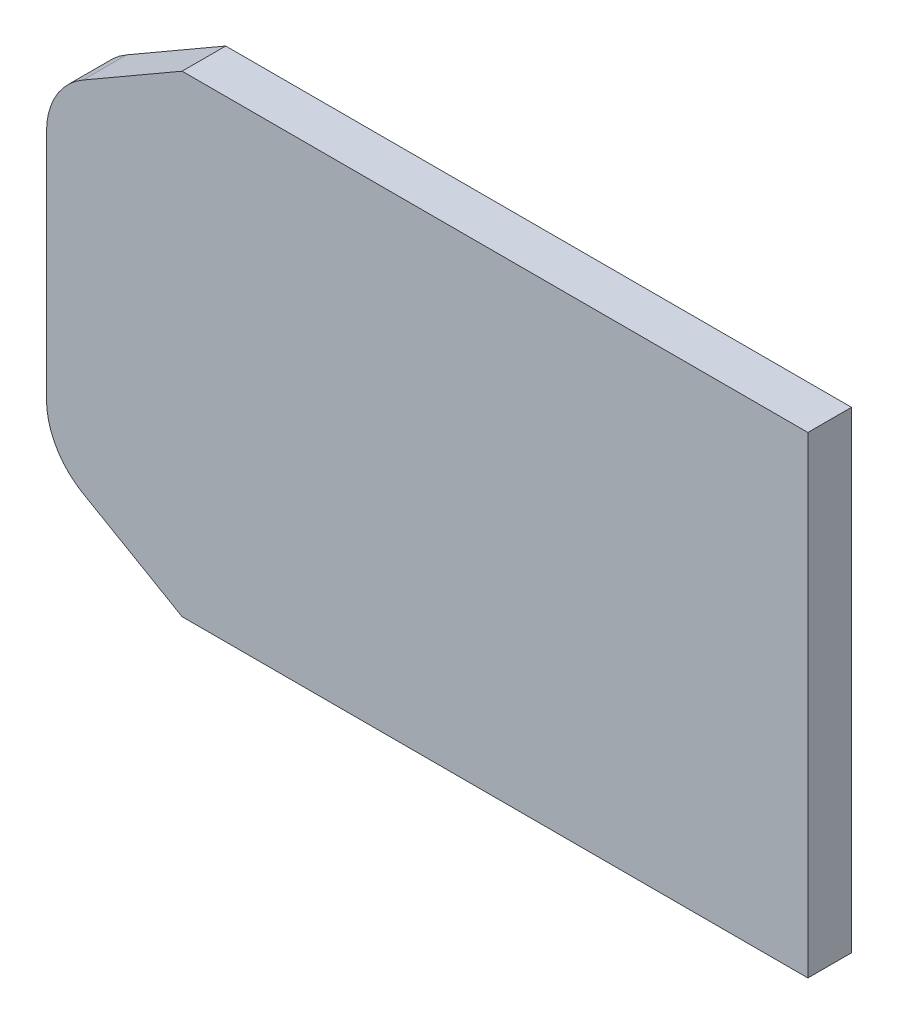
from build123d import *

# Parameters (mm, degrees)
BOSS_EXTRUDE1_DEPTH = 6


with BuildPart() as part:
    # Sketch1 → Boss-Extrude1 (new body)
    with BuildSketch(Plane.XY):
        with BuildLine():
            Line((-37.787642532, 307.932576411), (-123.887642532, 307.932576411))
            Line((-123.887642532, 307.932576411), (-137.545094515, 300.047977161))
            ThreePointArc((-137.545094515, 300.047977161), (-141.205529316, 296.38770347), (-142.545348637, 291.387576411))
            Line((-142.545348637, 291.387576411), (-142.545348637, 259.477576411))
            ThreePointArc((-142.545348637, 259.477576411), (-141.205529316, 254.477449351), (-137.545094515, 250.817175661))
            Line((-137.545094515, 250.817175661), (-123.887642532, 242.932576411))
            Line((-123.887642532, 242.932576411), (-37.787642532, 242.932576411))
            Line((-37.787642532, 242.932576411), (-37.787642532, 307.932576411))
        make_face()
    extrude(amount=BOSS_EXTRUDE1_DEPTH)


solid = part.part
